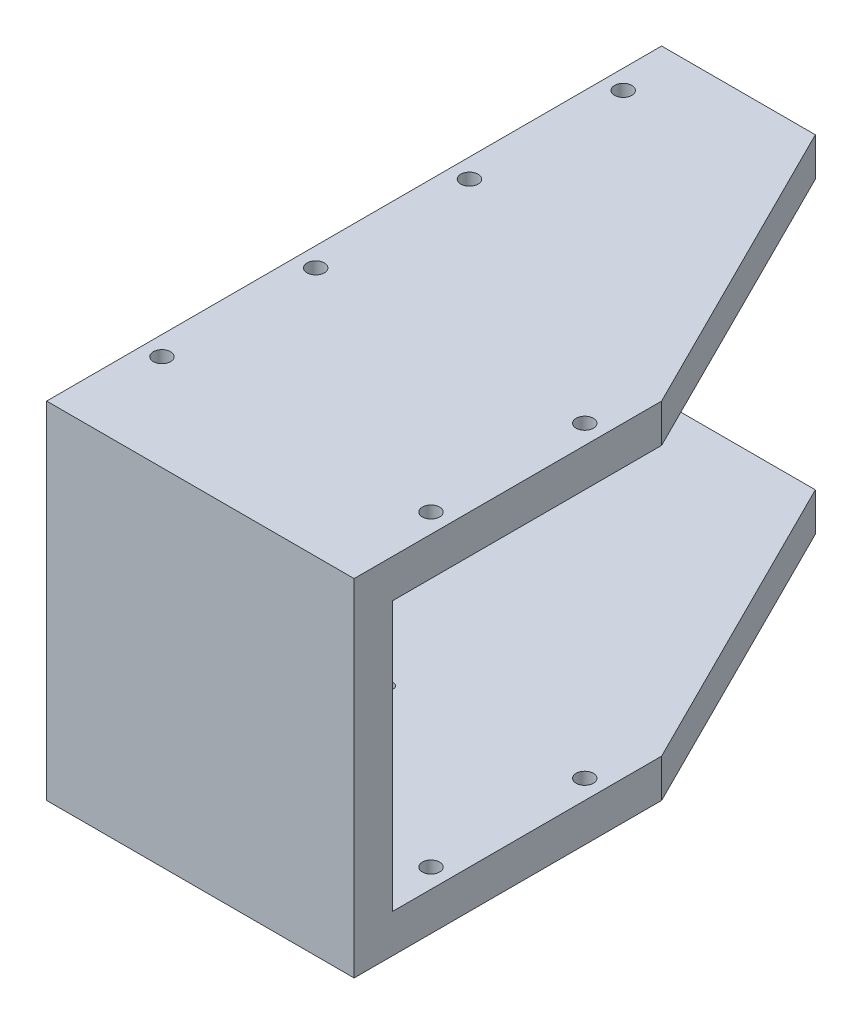
from build123d import *

# Parameters (mm, degrees)
SALIENTE_EXTRUIR1_DEPTH = 10
CROQUIS2_W              = 80
CROQUIS2_H              = 10
SALIENTE_EXTRUIR2_DEPTH = 70
SALIENTE_EXTRUIR3_DEPTH = 10
CROQUIS4_R              = 2.25
CORTAR_EXTRUIR1_DEPTH   = 201.249843945
CORTAR_EXTRUIR2_REACH   = 202.25
CROQUIS5_R              = 1.4


with BuildPart() as part:
    # Croquis1 → Saliente-Extruir1 (new body)
    with BuildSketch(Plane(origin=(0, 0, 0), x_dir=(1, 0, 0), z_dir=(0, 1, 0))):
        Polygon((0, 0), (0, 80), (-40, 160), (-80, 160), (-80, 0), align=None)
    extrude(amount=SALIENTE_EXTRUIR1_DEPTH)

    # Croquis2 → Saliente-Extruir2 (add)
    with BuildSketch(Plane(origin=(0, 10, 0), x_dir=(1, 0, 0), z_dir=(0, 1, 0))):
        with Locations((-40, 5)):
            Rectangle(CROQUIS2_W, CROQUIS2_H)
    extrude(amount=SALIENTE_EXTRUIR2_DEPTH)

    # Croquis3 → Saliente-Extruir3 (add)
    with BuildSketch(Plane(origin=(0, 80, 0), x_dir=(1, 0, 0), z_dir=(0, 1, 0))):
        Polygon((-80, 0), (0, 0), (0, 80), (-40, 160), (-80, 160), align=None)
    extrude(amount=SALIENTE_EXTRUIR3_DEPTH)

    # Croquis4 → Cortar-Extruir1 (cut, through all)
    with BuildSketch(Plane(origin=(0, 90, 0), x_dir=(1, 0, 0), z_dir=(0, 1, 0))):
        with Locations(Location((-75, 25, 0), (0, 0, 270))):
            Circle(CROQUIS4_R)
        with Locations(Location((-5, 25, 0), (0, 0, 270))):
            Circle(CROQUIS4_R)
        with Locations(Location((-5, 65, 0), (0, 0, 270))):
            Circle(CROQUIS4_R)
        with Locations(Location((-75, 65, 0), (0, 0, 270))):
            Circle(CROQUIS4_R)
        with Locations(Location((-75, 145, 0), (0, 0, 270))):
            Circle(CROQUIS4_R)
        with Locations(Location((-75, 105, 0), (0, 0, 270))):
            Circle(CROQUIS4_R)
    extrude(amount=-CORTAR_EXTRUIR1_DEPTH, mode=Mode.SUBTRACT)

    # Croquis5 → Cortar-Extruir2 (cut, up to next)
    with BuildSketch(Plane.XZ, mode=Mode.PRIVATE) as cortar_extruir2_sk1:
        with Locations(Location((-28.57, -29.76, 0), (0, 0, 270))):
            Circle(CROQUIS5_R)
    cortar_extruir2_tool1 = extrude(cortar_extruir2_sk1.sketch, amount=-CORTAR_EXTRUIR2_REACH, mode=Mode.PRIVATE) & part.part
    # Croquis5 → Cortar-Extruir2 (cut, up to next)
    with BuildSketch(Plane.XZ, mode=Mode.PRIVATE) as cortar_extruir2_sk2:
        with Locations(Location((-51.43, -60.24, 0), (0, 0, 270))):
            Circle(CROQUIS5_R)
    cortar_extruir2_tool2 = extrude(cortar_extruir2_sk2.sketch, amount=-CORTAR_EXTRUIR2_REACH, mode=Mode.PRIVATE) & part.part
    add(cortar_extruir2_tool1.solids().sort_by_distance((-28.57, 0, -29.76))[0], mode=Mode.SUBTRACT)
    add(cortar_extruir2_tool2.solids().sort_by_distance((-51.43, 0, -60.24))[0], mode=Mode.SUBTRACT)


solid = part.part
